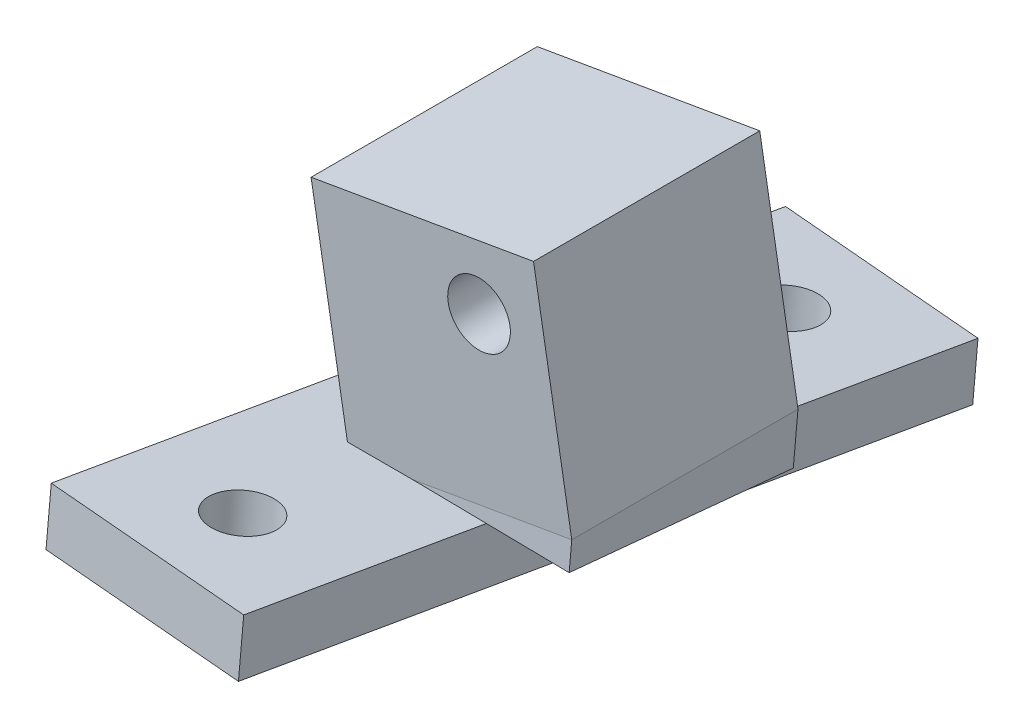
from build123d import *

# Parameters (mm, degrees)
SKETCH1_R           = 3.175
BOSS_EXTRUDE1_DEPTH = 22.9108
SKETCH2_R           = 3.175
BOSS_EXTRUDE2_DEPTH = 5.588
BOSS_EXTRUDE3_REACH = 318.687


with BuildPart() as part:
    # Sketch1 → Boss-Extrude1 (new body)
    with BuildSketch(Plane.XY):
        Polygon((-279.480965909, 265.178996639), (-302.009381101, 261.299549651), (-298.138391254, 238.820246093), (-275.609976062, 242.699693081), align=None)
        with Locations(Location((-285, 257.808220008, 0), (0, 0, 90))):
            Circle(SKETCH1_R, mode=Mode.SUBTRACT)
    extrude(amount=BOSS_EXTRUDE1_DEPTH)

    # Sketch2 → Boss-Extrude2 (add)
    with BuildSketch(Plane(origin=(0, 235.555558992, -22.588757095), x_dir=(1, 0, 0), z_dir=(0, 0.9954334818448494, -0.09545775621833992))):
        Polygon((-301.340789499, 1.892568588), (-307.73958618, -66.388261818), (-286.2437692, -68.40269781), (-279.844972519, -0.121867404), align=None)
        with Locations(Location((-291.422354653, -7.965868164, 0), (0, 0, 270))):
            Circle(SKETCH2_R, mode=Mode.SUBTRACT)
        with Locations(Location((-296.162204047, -58.544261058, 0), (0, 0, 270))):
            Circle(SKETCH2_R, mode=Mode.SUBTRACT)
    extrude(amount=-BOSS_EXTRUDE2_DEPTH)

    # Boss-Extrude3: up to this face of the body (flat: up to its plane)
    boss_extrude3_end = Plane(part.part.faces().sort_by_distance((-286.17802659, 240.879849499, 10.873584724))[0])
    # Sketch4 → Boss-Extrude3 (add, up to the picked face)
    with BuildSketch(Plane(origin=(0, 235.555558992, -22.588757095), x_dir=(1, 0, 0), z_dir=(0, 0.9954334818448495, -0.09545775621833982)), mode=Mode.PRIVATE) as boss_extrude3_sk1:
        Polygon((-291.759134886, -45.708284808), (-275.609976062, -45.973745552), (-275.609976062, -23.167568136), (-298.138391254, -22.797244832), (-298.138391254, -34.200333539), align=None)
    boss_extrude3_tool1 = split(extrude(boss_extrude3_sk1.sketch, amount=BOSS_EXTRUDE3_REACH, mode=Mode.PRIVATE), bisect_by=boss_extrude3_end, keep=Keep.BOTH, mode=Mode.PRIVATE)
    add(boss_extrude3_tool1.solids().sort_by(Axis((-286.178027, 238.783728, 11.074594), (0, 0.9954334818448495, -0.09545775621833982)))[0])


solid = part.part
